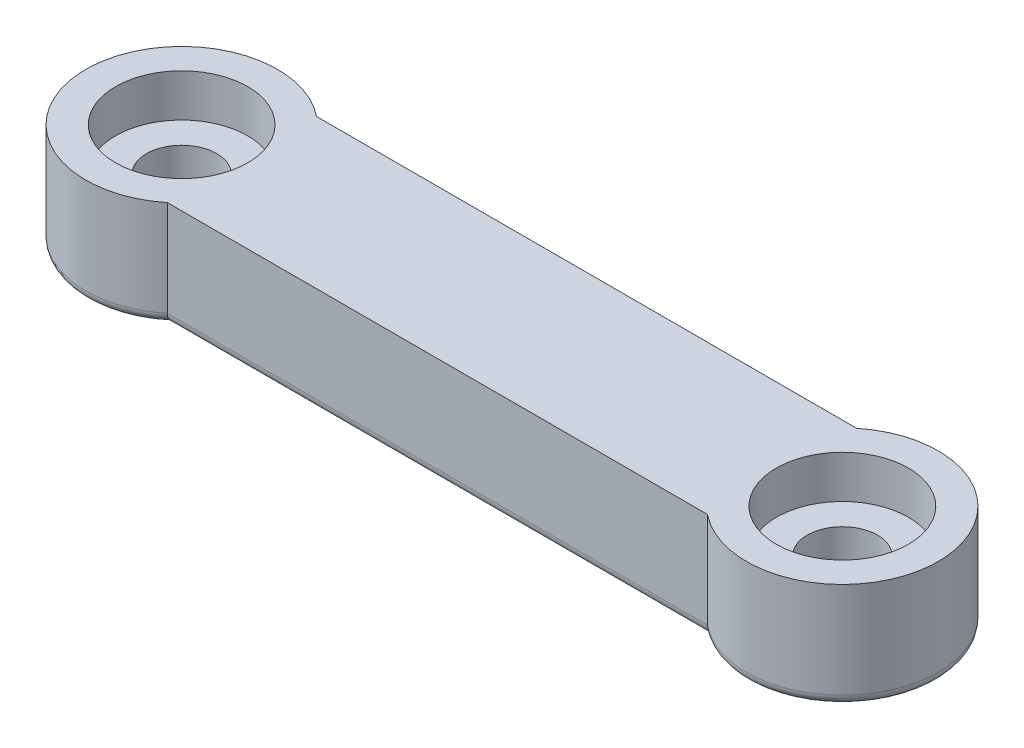
from build123d import *

# Parameters (mm, degrees)
SKETCH1_W           = 31
SKETCH1_H           = 7
BOSS_EXTRUDE1_DEPTH = 5
SKETCH2_R           = 4.5
BOSS_EXTRUDE2_DEPTH = 5
SKETCH3_R           = 1.65
CUT_EXTRUDE1_DEPTH  = 37.732138517
SKETCH4_R           = 3.1
CUT_EXTRUDE2_DEPTH  = 2
FILLET1_R           = 0.5


with BuildPart() as part:
    # Sketch1 → Boss-Extrude1 (new body)
    with BuildSketch(Plane(origin=(0, 0, 0), x_dir=(1, 0, 0), z_dir=(0, 1, 0))):
        with Locations((15.5, 3.5)):
            Rectangle(SKETCH1_W, SKETCH1_H)
    extrude(amount=BOSS_EXTRUDE1_DEPTH)

    # Sketch2 → Boss-Extrude2 (add)
    with BuildSketch(Plane(origin=(0, 5, 0), x_dir=(1, 0, 0), z_dir=(0, 1, 0))):
        with Locations((31, 3.5)):
            Circle(SKETCH2_R)
        with Locations((0, 3.5)):
            Circle(SKETCH2_R)
    extrude(amount=-BOSS_EXTRUDE2_DEPTH)

    # Sketch3 → Cut-Extrude1 (cut, through all)
    with BuildSketch(Plane(origin=(0, 5, 0), x_dir=(1, 0, 0), z_dir=(0, 1, 0))):
        with Locations(Location((0, 3.5, 0), (0, 0, 270))):
            Circle(SKETCH3_R)
        with Locations(Location((31, 3.5, 0), (0, 0, 270))):
            Circle(SKETCH3_R)
    extrude(amount=-CUT_EXTRUDE1_DEPTH, mode=Mode.SUBTRACT)

    # Sketch4 → Cut-Extrude2 (cut)
    with BuildSketch(Plane(origin=(0, 5, 0), x_dir=(1, 0, 0), z_dir=(0, 1, 0))):
        with Locations(Location((0, 3.5, 0), (0, 0, 270))):
            Circle(SKETCH4_R)
        with Locations(Location((31, 3.5, 0), (0, 0, 270))):
            Circle(SKETCH4_R)
    extrude(amount=-CUT_EXTRUDE2_DEPTH, mode=Mode.SUBTRACT)

    # Fillet1
    fillet1_edges = [part.edges().sort_by_distance(p)[0] for p in [
        (15.5, 0, -7),
        (35.5, 0, -3.5),
        (15.5, 0, 0),
        (-4.5, 0, -3.5),
    ]]
    fillet(fillet1_edges, radius=FILLET1_R)


solid = part.part
